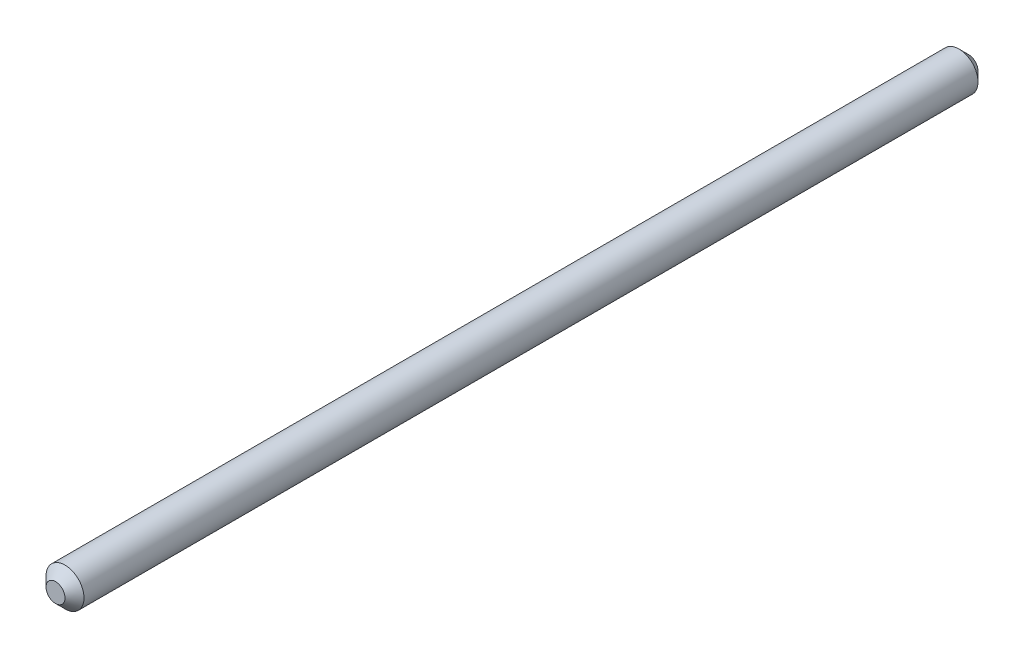
from build123d import *

# Parameters (mm, degrees)
SKETCH1_R           = 1
BOSS_EXTRUDE1_DEPTH = 48
CHAMFER1_SIZE       = 0.5


with BuildPart() as part:
    # Sketch1 → Boss-Extrude1 (new body)
    with BuildSketch(Plane.XY):
        Circle(SKETCH1_R)
    extrude(amount=-BOSS_EXTRUDE1_DEPTH)

    # Chamfer1
    chamfer1_edges = [part.edges().sort_by_distance(p)[0] for p in [
        (-1, 0, 0),
        (-1, 0, -48),
    ]]
    chamfer(chamfer1_edges, length=CHAMFER1_SIZE)


solid = part.part
